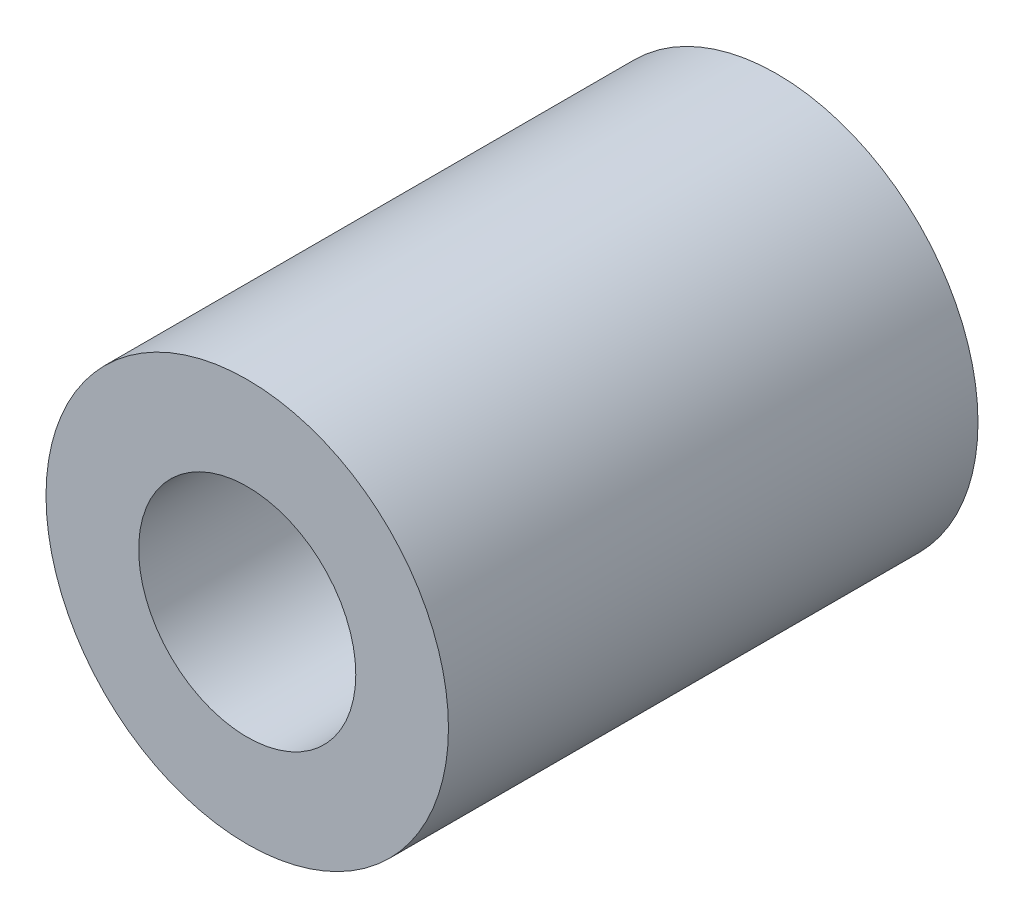
from build123d import *

# Parameters (mm, degrees)
ESQUISSE1_R             = 9.5
BOSS_EXTRU_1_DEPTH      = 25
ESQUISSE2_R             = 5.125
ENL_V_MAT_EXTRU_1_DEPTH = 18
ESQUISSE3_R             = 3.125
ENL_V_MAT_EXTRU_2_DEPTH = 18


with BuildPart() as part:
    # Esquisse1 → Boss.-Extru.1 (new body)
    with BuildSketch(Plane.XY):
        Circle(ESQUISSE1_R)
    extrude(amount=BOSS_EXTRU_1_DEPTH)

    # Esquisse2 → Enlèv. mat.-Extru.1 (cut)
    with BuildSketch(Plane.XY.offset(25)):
        Circle(ESQUISSE2_R)
    extrude(amount=-ENL_V_MAT_EXTRU_1_DEPTH, mode=Mode.SUBTRACT)

    # Esquisse3 → Enlèv. mat.-Extru.2 (cut)
    with BuildSketch(Plane(origin=(0, 0, 0), x_dir=(-1, 0, 0), z_dir=(0, 0, -1))):
        Circle(ESQUISSE3_R)
    extrude(amount=-ENL_V_MAT_EXTRU_2_DEPTH, mode=Mode.SUBTRACT)


solid = part.part
